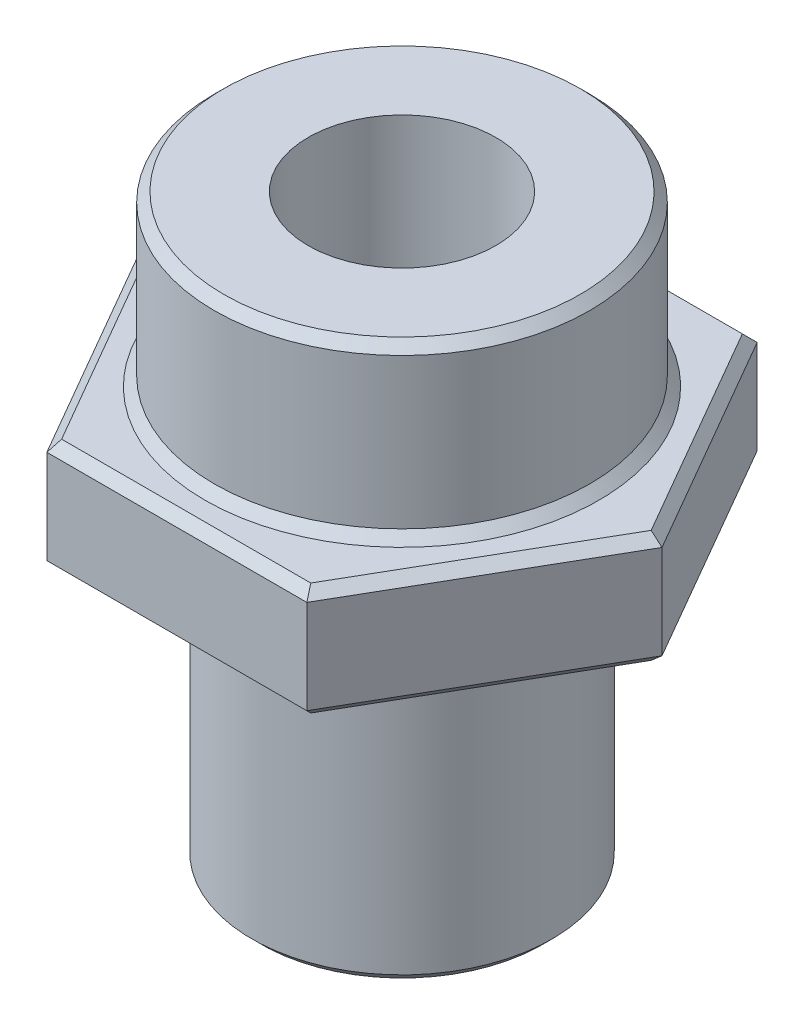
from build123d import *

# Parameters (mm, degrees)
BOSS_EXTRUDE1_DEPTH = 3
CHAMFER1_SIZE       = 0.25


with BuildPart() as part:
    # Sketch3 → Revolve1 (revolve)
    with BuildSketch(Plane.XY, mode=Mode.PRIVATE) as revolve1_sk:
        Polygon((-5, 0), (-5, -4.5), (-6, -4.5), (-6, -7.5), (-4, -7.5), (-4, -15.5), (-2.5, -15.5), (-2.5, 0), align=None)
    revolve(revolve1_sk.sketch.rotate(Axis((0, 0, 0), (0, -1, 0)), 270), axis=Axis((0, 0, 0), (0, -1, 0)))

    # Sketch4 → Boss-Extrude1 (add)
    with BuildSketch(Plane(origin=(0, -4.5, 0), x_dir=(1, 0, 0), z_dir=(0, 1, 0))):
        Polygon((-3.464101615, 6), (-6.92820323, 0), (-3.464101615, -6), (3.464101615, -6), (6.92820323, 0), (3.464101615, 6), align=None)
    extrude(amount=-BOSS_EXTRUDE1_DEPTH)

    # Chamfer1
    chamfer1_edges = [part.edges().sort_by_distance(p)[0] for p in [
        (0, -4.5, 6),
        (-5.196152423, -4.5, 3),
        (-5.196152423, -4.5, -3),
        (0, -4.5, -6),
        (5.196152423, -4.5, -3),
        (5.196152423, -4.5, 3),
        (-5.196152423, -7.5, -3),
        (-5.196152423, -7.5, 3),
        (0, -7.5, 6),
        (5.196152423, -7.5, 3),
        (5.196152423, -7.5, -3),
        (0, -7.5, -6),
        (0, -15.5, -4),
        (0, -7.5, -4),
        (0, -4.5, -5),
        (0, 0, -5),
    ]]
    chamfer(chamfer1_edges, length=CHAMFER1_SIZE)


solid = part.part
